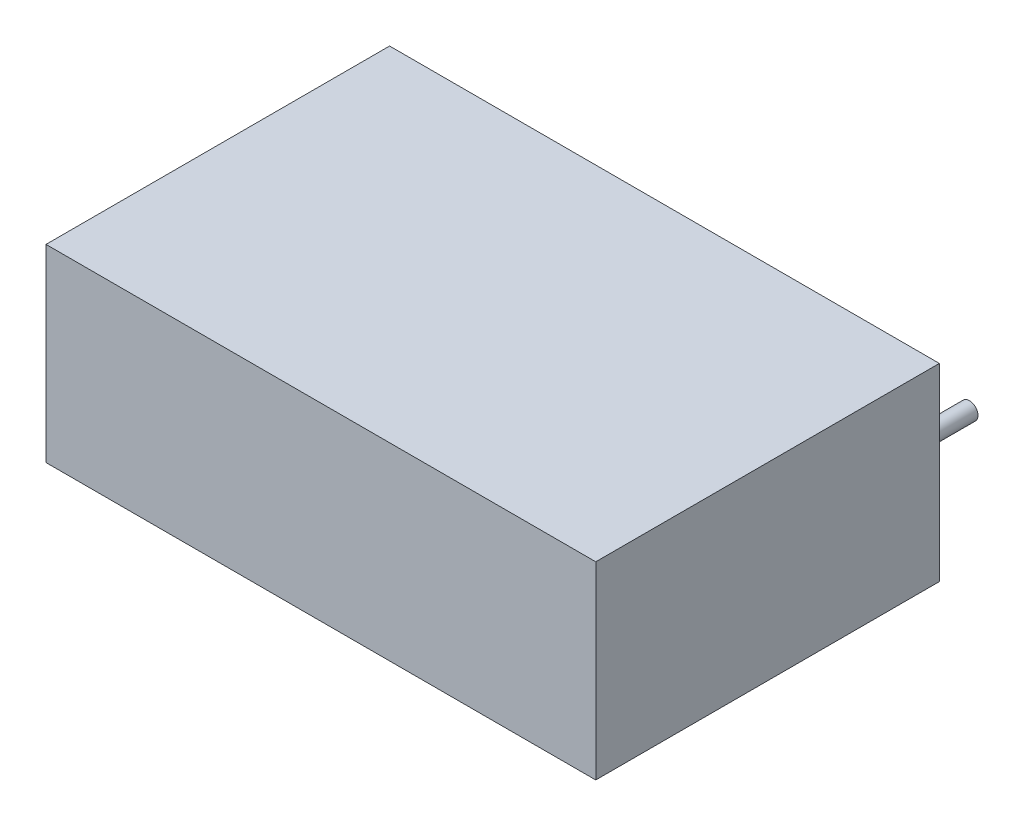
from build123d import *

# Parameters (mm, degrees)
SKETCH_2_W      = 32
SKETCH_2_H      = 11
EXTRUDE_1_DEPTH = 20
SKETCH_3_R      = 0.5
EXTRUDE_2_DEPTH = 4


with BuildPart() as part:
    # Эскиз2 → Вытянуть1 (new body)
    with BuildSketch(Plane.XY):
        with Locations((15.5, 0)):
            Rectangle(SKETCH_2_W, SKETCH_2_H)
    extrude(amount=EXTRUDE_1_DEPTH)

    # Эскиз3 → Вытянуть2 (add)
    with BuildSketch(Plane(origin=(0, 0, 0), x_dir=(-1, 0, 0), z_dir=(0, 0, -1))):
        with Locations(Location((-1.75, 0, 0), (0, 0, 180))):
            Circle(SKETCH_3_R)
        with Locations(Location((-29.25, 0, 0), (0, 0, 180))):
            Circle(SKETCH_3_R)
    extrude(amount=EXTRUDE_2_DEPTH)


solid = part.part
